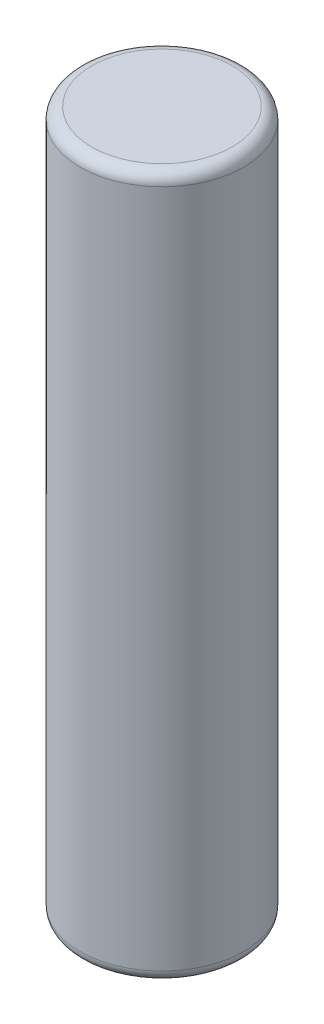
from build123d import *

# Parameters (mm, degrees)
SKETCH1_R           = 7
BOSS_EXTRUDE1_DEPTH = 60
FILLET1_R           = 1


with BuildPart() as part:
    # Sketch1 → Boss-Extrude1 (new body)
    with BuildSketch(Plane(origin=(0, 0, 0), x_dir=(1, 0, 0), z_dir=(0, 1, 0))):
        with Locations(Location((0, 0, 0), (0, 0, 270))):
            Circle(SKETCH1_R)
    extrude(amount=BOSS_EXTRUDE1_DEPTH)

    # Fillet1
    fillet1_edges = [part.edges().sort_by_distance(p)[0] for p in [
        (0, 0, -7),
        (0, 60, -7),
    ]]
    fillet(fillet1_edges, radius=FILLET1_R)


solid = part.part
